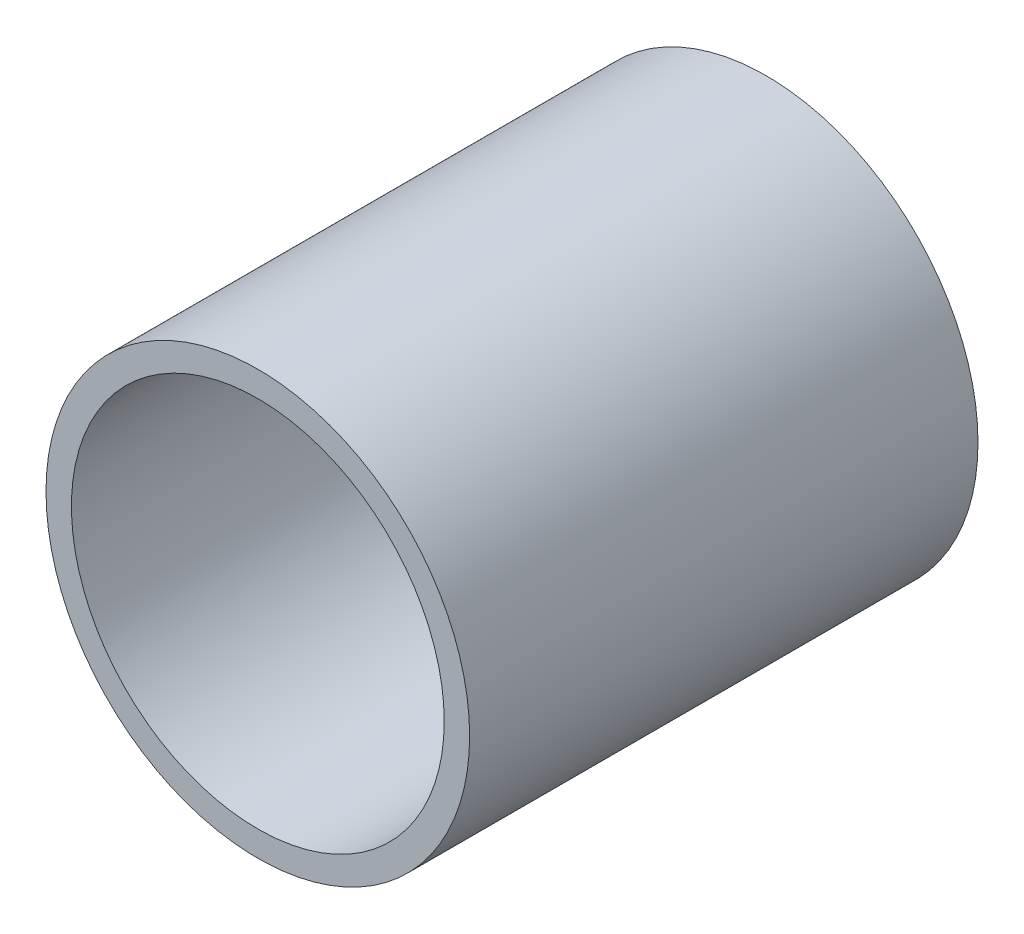
from build123d import *

# Parameters (mm, degrees)
SKETCH1_R           = 2.5
SKETCH1_R_2         = 2.2
BOSS_EXTRUDE1_DEPTH = 6


with BuildPart() as part:
    # Sketch1 → Boss-Extrude1 (new body)
    with BuildSketch(Plane.XY):
        Circle(SKETCH1_R)
        Circle(SKETCH1_R_2, mode=Mode.SUBTRACT)
    extrude(amount=BOSS_EXTRUDE1_DEPTH)


solid = part.part
